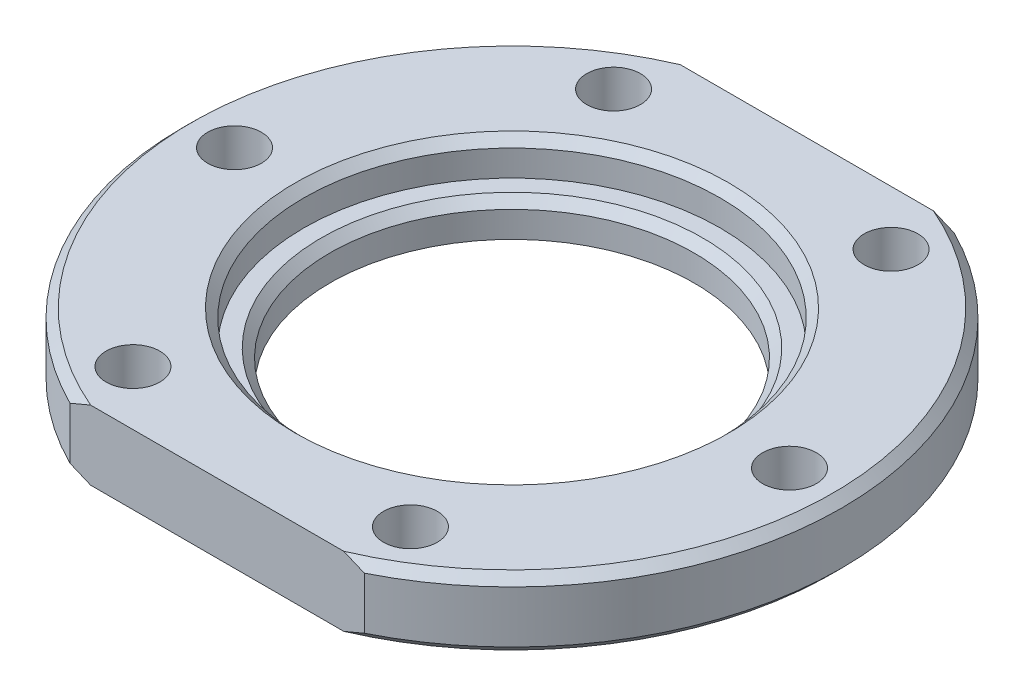
from build123d import *

# Parameters (mm, degrees)
SKETCH1_R           = 10.5
SKETCH1_R_2         = 1.55
BOSS_EXTRUDE1_DEPTH = 4
SKETCH2_R           = 12
CUT_EXTRUDE1_DEPTH  = 2
CHAMFER1_SIZE       = 0.5


with BuildPart() as part:
    # Sketch1 → Boss-Extrude1 (new body)
    with BuildSketch(Plane(origin=(0, 0, 0), x_dir=(1, 0, 0), z_dir=(0, 1, 0))):
        with BuildLine():
            Line((-8.485281374, 17), (8.485281374, 17))
            ThreePointArc((8.485281374, 17), (19, 0), (8.485281374, -17))
            Line((8.485281374, -17), (-8.485281374, -17))
            ThreePointArc((-8.485281374, -17), (-19, 0), (-8.485281374, 17))
        make_face()
        with Locations(Location((0, 0, 0), (0, 0, 270))):
            Circle(SKETCH1_R, mode=Mode.SUBTRACT)
        with Locations(Location((-16, 0, 0), (0, 0, 270))):
            Circle(SKETCH1_R_2, mode=Mode.SUBTRACT)
        with Locations(Location((-8, 13.856406461, 0), (0, 0, 270))):
            Circle(SKETCH1_R_2, mode=Mode.SUBTRACT)
        with Locations(Location((8, 13.856406461, 0), (0, 0, 270))):
            Circle(SKETCH1_R_2, mode=Mode.SUBTRACT)
        with Locations(Location((16, 0, 0), (0, 0, 270))):
            Circle(SKETCH1_R_2, mode=Mode.SUBTRACT)
        with Locations(Location((8, -13.856406461, 0), (0, 0, 270))):
            Circle(SKETCH1_R_2, mode=Mode.SUBTRACT)
        with Locations(Location((-8, -13.856406461, 0), (0, 0, 270))):
            Circle(SKETCH1_R_2, mode=Mode.SUBTRACT)
    extrude(amount=BOSS_EXTRUDE1_DEPTH)

    # Sketch2 → Cut-Extrude1 (cut)
    with BuildSketch(Plane(origin=(0, 4, 0), x_dir=(1, 0, 0), z_dir=(0, 1, 0))):
        with Locations(Location((0, 0, 0), (0, 0, 270))):
            Circle(SKETCH2_R)
    extrude(amount=-CUT_EXTRUDE1_DEPTH, mode=Mode.SUBTRACT)

    # Chamfer1
    chamfer1_edges = [part.edges().sort_by_distance(p)[0] for p in [
        (19, 4, 0),
        (0, 2, -10.5),
        (0, 4, -12),
        (-19, 4, 0),
        (19, 0, 0),
        (-19, 0, 0),
    ]]
    chamfer(chamfer1_edges, length=CHAMFER1_SIZE)


solid = part.part
